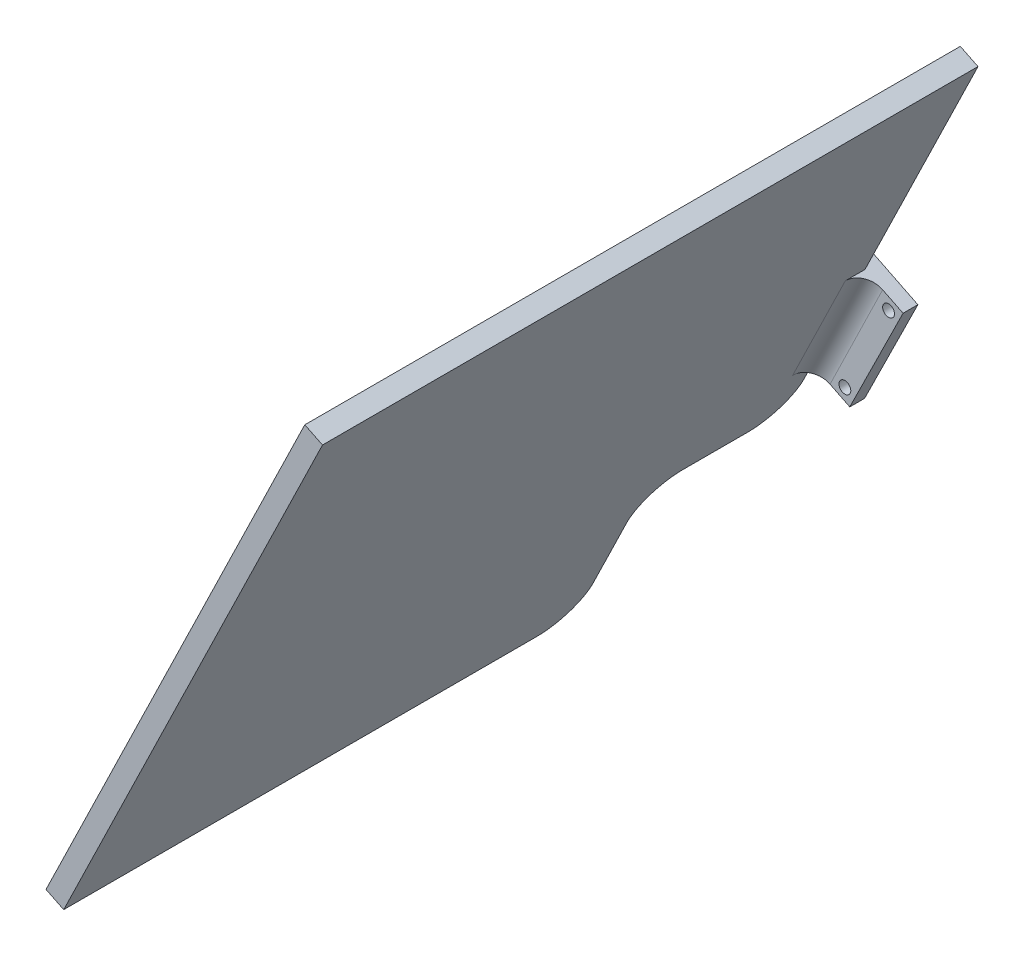
from build123d import *

# Parameters (mm, degrees)
SKETCH_1_R          = 1.2
EXTRUDE_1_DEPTH     = 3
EXTRUDE_2_DEPTH     = 133
FILLET_1_R          = 4
SKETCH_4_W          = 29.077288304
SKETCH_4_H          = 31.423180799
CUT_EXTRUDE_1_DEPTH = 4
FILLET_3_R          = 8


with BuildPart() as part:
    # 草图1 → 凸台-拉伸1 (new body)
    with BuildSketch(Plane.XY):
        Polygon((-67.574588252, 2.235418745), (-78.389048292, -19.637108636), (-56.517207821, -30.451229046), (-45.702747781, -8.578701665), align=None)
        with Locations((-66.577549394, -0.711768645)):
            Circle(SKETCH_1_R, mode=Mode.SUBTRACT)
        with Locations((-75.441860902, -18.640069777)):
            Circle(SKETCH_1_R, mode=Mode.SUBTRACT)
        with Locations((-57.51355977, -27.504381286)):
            Circle(SKETCH_1_R, mode=Mode.SUBTRACT)
        with Locations((-48.649248262, -9.576080153)):
            Circle(SKETCH_1_R, mode=Mode.SUBTRACT)
    extrude(amount=EXTRUDE_1_DEPTH)

    # 草图2 → 凸台-拉伸2 (add)
    with BuildSketch(Plane.XY.offset(3)):
        Polygon((-86.606649797, -63.783530386), (-34.098567754, 44.118746329), (-30.501825197, 42.368476928), (-83.00990724, -65.533799787), align=None)
    extrude(amount=EXTRUDE_2_DEPTH)

    # 圆角1
    fillet_1_edges = [part.edges().sort_by_distance(p)[0] for p in [
        (-58.772343801, -15.726452512, 3),
        (-62.358074987, -13.953555126, 3),
    ]]
    fillet(fillet_1_edges, radius=FILLET_1_R)

    # 草图4 → 切除-拉伸1 (cut)
    with BuildSketch(Plane(origin=(-44.928588602, 21.863431321, 0), x_dir=(0, 0, 1), z_dir=(-0.8991856392880848, 0.43756735035658034, 0))):
        with Locations((17.538644152, -79.537886422)):
            Rectangle(SKETCH_4_W, SKETCH_4_H)
    extrude(amount=-CUT_EXTRUDE_1_DEPTH, mode=Mode.SUBTRACT)

    # 圆角3
    fillet_3_edges = [part.edges().sort_by_distance(p)[0] for p in [
        (-71.058520557, -36.403392171, 3),
        (-71.058520557, -36.403392171, 32.077288304),
        (-84.808278518, -64.658665086, 32.077288304),
    ]]
    fillet(fillet_3_edges, radius=FILLET_3_R)


solid = part.part
